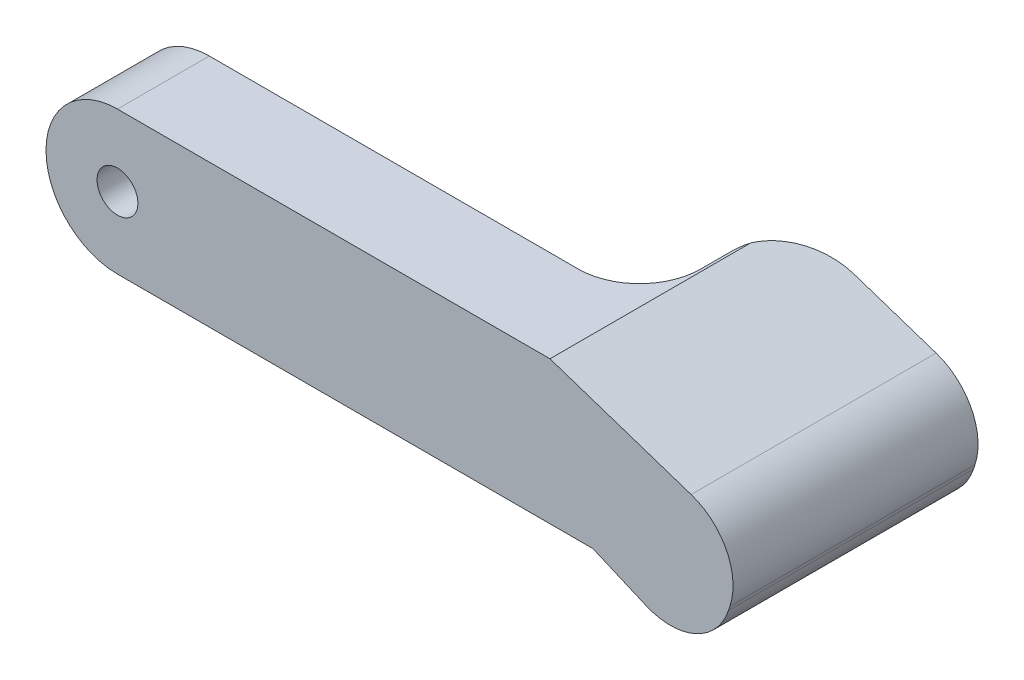
from build123d import *

# Parameters (mm, degrees)
RESSALTO_EXTRUS_O1_DEPTH = 12
ESBO_O2_W                = 27.357600802
ESBO_O2_H                = 15.919060402
CORTE_EXTRUS_O1_DEPTH    = 7.5
FILETE1_R                = 3
ESBO_O3_R                = 2.25
CORTE_EXTRUS_O2_DEPTH    = 2.5
FILETE2_R                = 3
ESBO_O4_R                = 1
CORTE_EXTRUS_O3_DEPTH    = 33.811931028


with BuildPart() as part:
    # Esboço1 → Ressalto-extrusão1 (new body)
    with BuildSketch(Plane.XY):
        with BuildLine():
            Line((21.183373259, 3.5), (0, 3.5))
            ThreePointArc((0, 3.5), (-3.5, 0), (0, -3.5))
            Line((0, -3.5), (23.285443563, -3.5))
            Line((23.285443563, -3.5), (28.893826204, -5.90573293))
            Line((28.893826204, -5.90573293), (30.943148627, 0.251790361))
            Line((30.943148627, 0.251790361), (21.183373259, 3.5))
        make_face()
    extrude(amount=RESSALTO_EXTRUS_O1_DEPTH)

    # Esboço2 → Corte-extrusão1 (cut)
    with BuildSketch(Plane(origin=(0, 0, 0), x_dir=(-1, 0, 0), z_dir=(0, 0, -1))):
        with Locations((-7.389764087, -0.137286393)):
            Rectangle(ESBO_O2_W, ESBO_O2_H)
    extrude(amount=-CORTE_EXTRUS_O1_DEPTH, mode=Mode.SUBTRACT)

    # Filete1
    filete1_edges = [part.edges().sort_by_distance(p)[0] for p in [
        (30.943148627, 0.251790361, 6),
        (28.893826204, -5.90573293, 6),
    ]]
    fillet(filete1_edges, radius=FILETE1_R)

    # Esboço3 → Corte-extrusão2 (cut)
    with BuildSketch(Plane(origin=(0, 0, 7.5), x_dir=(-1, 0, 0), z_dir=(0, 0, -1))):
        Circle(ESBO_O3_R)
    extrude(amount=-CORTE_EXTRUS_O2_DEPTH, mode=Mode.SUBTRACT)

    # Filete2
    filete2_edges = [part.edges().sort_by_distance(p)[0] for p in [
        (21.068564488, 0, 7.5),
        (21.068564488, 0, 0),
    ]]
    fillet(filete2_edges, radius=FILETE2_R)

    # Esboço4 → Corte-extrusão3 (cut, through all)
    with BuildSketch(Plane.XY.offset(12)):
        Circle(ESBO_O4_R)
    extrude(amount=-CORTE_EXTRUS_O3_DEPTH, mode=Mode.SUBTRACT)


solid = part.part
